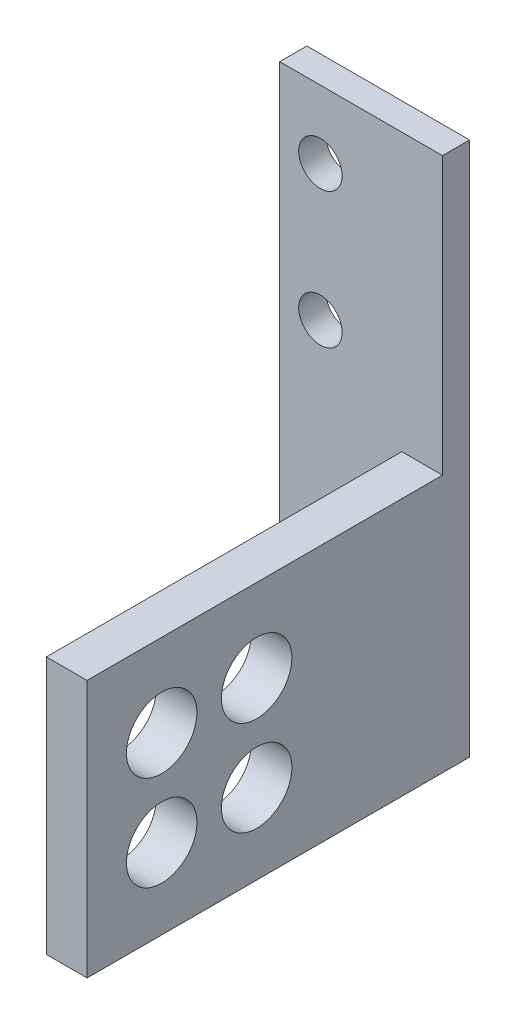
from build123d import *

# Parameters (mm, degrees)
FOOT_SKETCH_W              = 12
FOOT_SKETCH_H              = 39.4
FOOT_DEPTH                 = 2
UPRIGHT_SKETCH_W           = 3
UPRIGHT_SKETCH_H           = 19
UPRIGHT_DEPTH              = 26.2
SHEATH_HOLES_SKETCH_R      = 2.6
SHEATH_HOLES_DEPTH         = 3
SERVO_SCREW_HOLES_SKETCH_R = 1.6
SERVO_SCREW_HOLES_DEPTH    = 15


with BuildPart() as part:
    # Foot Sketch → Foot (new body)
    with BuildSketch(Plane.XY.offset(-4)):
        with Locations((-73.35, 73.7)):
            Rectangle(FOOT_SKETCH_W, FOOT_SKETCH_H)
    extrude(amount=FOOT_DEPTH)

    # Upright Sketch → Upright (add)
    with BuildSketch(Plane.XY.offset(-2)):
        with Locations((-68.85, 63.5)):
            Rectangle(UPRIGHT_SKETCH_W, UPRIGHT_SKETCH_H)
    extrude(amount=UPRIGHT_DEPTH)

    # Sheath Holes Sketch → Sheath Holes (cut)
    with BuildSketch(Plane(origin=(-70.35, 0, 0), x_dir=(0, 0, -1), z_dir=(1, 0, 0))):
        with Locations((-18.7, 66.9)):
            Circle(SHEATH_HOLES_SKETCH_R)
        with Locations((-11.7, 59.9)):
            Circle(SHEATH_HOLES_SKETCH_R)
        with Locations((-11.7, 66.9)):
            Circle(SHEATH_HOLES_SKETCH_R)
        with Locations((-18.7, 59.9)):
            Circle(SHEATH_HOLES_SKETCH_R)
    extrude(amount=SHEATH_HOLES_DEPTH, mode=Mode.SUBTRACT)

    # Servo Screw Holes Sketch → Servo Screw Holes (cut, symmetric)
    with BuildSketch(Plane.XY):
        with Locations((-76.35, 78.4)):
            Circle(SERVO_SCREW_HOLES_SKETCH_R)
        with Locations((-76.35, 88.4)):
            Circle(SERVO_SCREW_HOLES_SKETCH_R)
    extrude(amount=SERVO_SCREW_HOLES_DEPTH, both=True, mode=Mode.SUBTRACT)


solid = part.part
